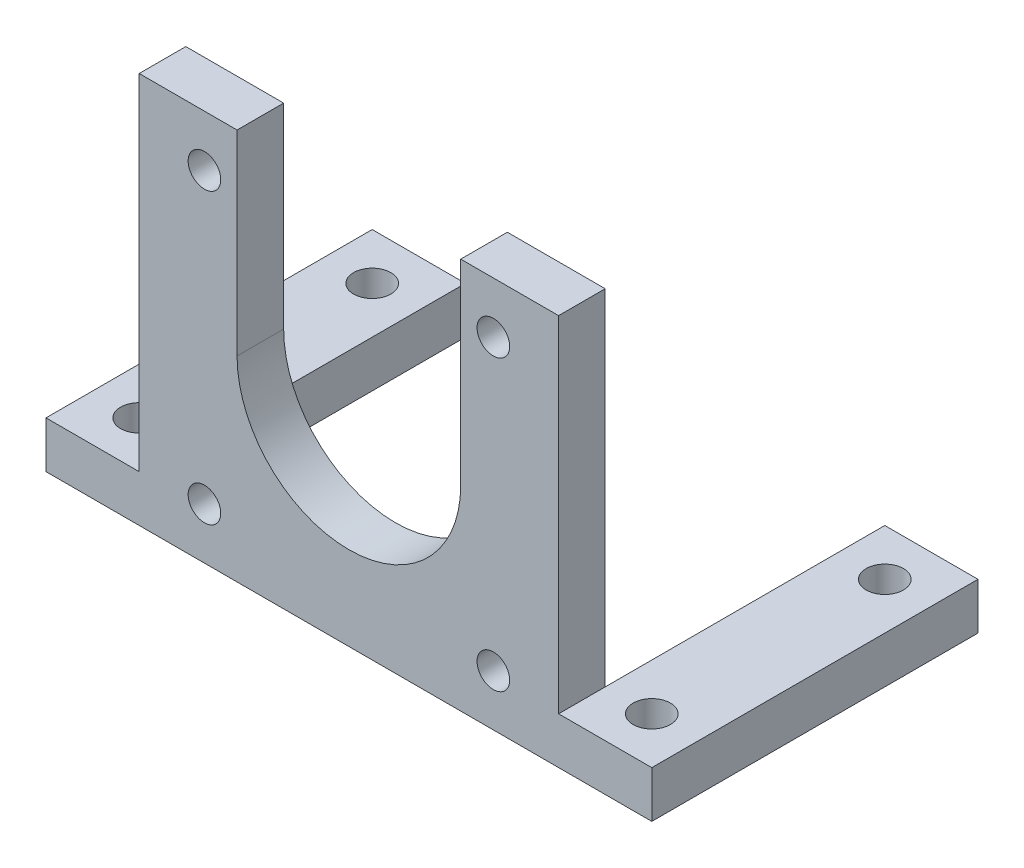
from build123d import *

# Parameters (mm, degrees)
ESBO_O1_R                = 1.75
RESSALTO_EXTRUS_O1_DEPTH = 5
ESBO_O2_W                = 10
ESBO_O2_H                = 35
ESBO_O2_R                = 2
RESSALTO_EXTRUS_O2_DEPTH = 5


with BuildPart() as part:
    # Esboço1 → Ressalto-extrusão1 (new body)
    with BuildSketch(Plane.XY):
        with BuildLine():
            Line((-12, 0), (-12, 21))
            Line((-12, 21), (-22.5, 21))
            Line((-22.5, 21), (-22.5, -21))
            Line((-22.5, -21), (22.5, -21))
            Line((22.5, -21), (22.5, 21))
            Line((22.5, 21), (12, 21))
            Line((12, 21), (12, 0))
            ThreePointArc((12, 0), (0, -12), (-12, 0))
        make_face()
        with Locations((-15.5, 15.5)):
            Circle(ESBO_O1_R, mode=Mode.SUBTRACT)
        with Locations((15.5, 15.5)):
            Circle(ESBO_O1_R, mode=Mode.SUBTRACT)
        with Locations((15.5, -15.5)):
            Circle(ESBO_O1_R, mode=Mode.SUBTRACT)
        with Locations((-15.5, -15.5)):
            Circle(ESBO_O1_R, mode=Mode.SUBTRACT)
    extrude(amount=RESSALTO_EXTRUS_O1_DEPTH)

    # Esboço2 → Ressalto-extrusão2 (add)
    # profile 1 of 2: a face of its own
    with BuildSketch(Plane.XZ.offset(21)):
        with Locations((-27.5, -12.5)):
            Rectangle(ESBO_O2_W, ESBO_O2_H)
        with Locations(Location((-27.5, -25, 0), (0, 0, 270))):
            Circle(ESBO_O2_R, mode=Mode.SUBTRACT)
        with Locations(Location((-27.5, 0, 0), (0, 0, 270))):
            Circle(ESBO_O2_R, mode=Mode.SUBTRACT)
    # profile 2 of 2: a face of its own
    with BuildSketch(Plane.XZ.offset(21)):
        with Locations((27.5, -12.5)):
            Rectangle(ESBO_O2_W, ESBO_O2_H)
        with Locations(Location((27.5, 0, 0), (0, 0, 90))):
            Circle(ESBO_O2_R, mode=Mode.SUBTRACT)
        with Locations(Location((27.5, -25, 0), (0, 0, 90))):
            Circle(ESBO_O2_R, mode=Mode.SUBTRACT)
    extrude(amount=-RESSALTO_EXTRUS_O2_DEPTH)


solid = part.part
